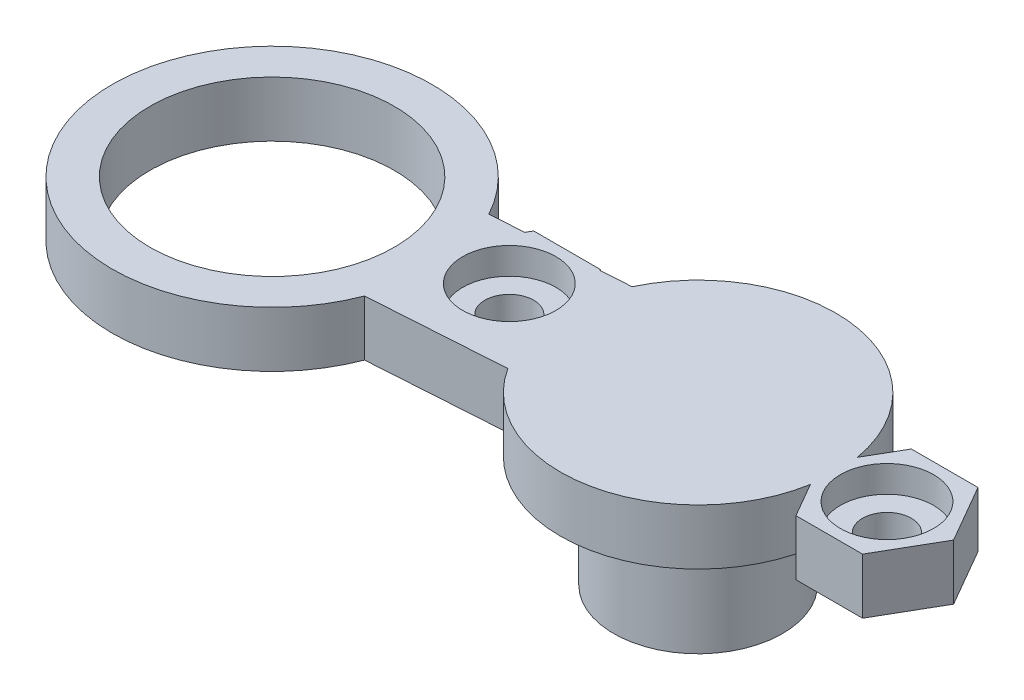
from build123d import *

# Parameters (mm, degrees)
RETAINER_FEATURE_1_PROFILE_R  = 3.8
RETAINER_FEATURE_1_DEPTH      = 5.02
RETAINER_FEATURE_2_PROFILE_R  = 6.2
RETAINER_FEATURE_2_DEPTH      = 2.5
RETAINER_FEATURE_5_DEPTH      = 2.5
RETAINER_FEATURE_8_DEPTH      = 2.5
RETAINER_FEATURE_12_DEPTH     = 2.5
RETAINER_FEATURE_13_PROFILE_R = 7.2
RETAINER_FEATURE_13_DEPTH     = 2.5
RETAINER_FEATURE_14_PROFILE_R = 5.5
RETAINER_FEATURE_14_DEPTH     = 2.7
RETAINER_FEATURE_15_PROFILE_R = 1.1
RETAINER_FEATURE_15_DEPTH     = 3.75
RETAINER_FEATURE_16_PROFILE_R = 2.1
RETAINER_FEATURE_16_DEPTH     = 1.45
RETAINER_FEATURE_17_PROFILE_R = 1.1
RETAINER_FEATURE_17_DEPTH     = 3.75
RETAINER_FEATURE_18_PROFILE_R = 2.1
RETAINER_FEATURE_18_DEPTH     = 1.45


with BuildPart() as part:
    # Retainer Feature 1 profile → Retainer Feature 1 (new body)
    with BuildSketch(Plane(origin=(0, -101, 0), x_dir=(-1, 0, 0), z_dir=(0, -1, 0))):
        with Locations(Location((56.291651246, -30, 0), (0, 0, 90))):
            Circle(RETAINER_FEATURE_1_PROFILE_R)
    extrude(amount=RETAINER_FEATURE_1_DEPTH)

    # Retainer Feature 2 profile → Retainer Feature 2 (add)
    with BuildSketch(Plane(origin=(0, -106, 0), x_dir=(-1, 0, 0), z_dir=(0, -1, 0))):
        with Locations(Location((56.291651246, -30, 0), (0, 0, 90))):
            Circle(RETAINER_FEATURE_2_PROFILE_R)
    extrude(amount=RETAINER_FEATURE_2_DEPTH)

    # Middle Right Floating Compression Ball R → Retainer Feature 5 (add)
    with BuildSketch(Plane(origin=(0, -106, 0), x_dir=(-1, 0, 0), z_dir=(0, -1, 0))):
        Polygon((44.791651246, -30), (46.291651246, -32.598076211), (49.291651246, -32.598076211), (50.791651246, -30), (49.291651246, -27.401923789), (46.291651246, -27.401923789), align=None)
    extrude(amount=RETAINER_FEATURE_5_DEPTH)

    # Middle Right Floating Compression Ba 2 → Retainer Feature 8 (add)
    with BuildSketch(Plane(origin=(0, -106, 0), x_dir=(-1, 0, 0), z_dir=(0, -1, 0))):
        Polygon((61.791651246, -30), (63.291651246, -32.598076211), (66.291651246, -32.598076211), (67.791651246, -30), (66.291651246, -27.401923789), (63.291651246, -27.401923789), align=None)
    extrude(amount=RETAINER_FEATURE_8_DEPTH)

    # Retainer Feature 9 profile → Retainer Feature 9 (revolve, cut)
    with BuildSketch(Plane(origin=(0, -101, 0), x_dir=(-1, 0, 0), z_dir=(0, -1, 0))):
        with BuildLine():
            Line((56.291651246, -33.15), (56.291651246, -26.85))
            ThreePointArc((56.291651246, -26.85), (53.141651246, -30), (56.291651246, -33.15))
        make_face()
    revolve(axis=Axis((-56.291651246, -101, 20), (0, 0, 1)), mode=Mode.SUBTRACT)

    # Middle Right Floating Compression Ba 3 → Retainer Feature 12 (add)
    with BuildSketch(Plane(origin=(0, -106, 0), x_dir=(-1, 0, 0), z_dir=(0, -1, 0))):
        Polygon((56.095916768, -32.993607859), (74.095916768, -34.170522395), (74.487385724, -28.183306677), (56.487385724, -27.006392141), align=None)
    extrude(amount=RETAINER_FEATURE_12_DEPTH)

    # Retainer Feature 13 profile → Retainer Feature 13 (add)
    with BuildSketch(Plane(origin=(0, -106, 0), x_dir=(-1, 0, 0), z_dir=(0, -1, 0))):
        with Locations((74.291651246, -31.176914536)):
            Circle(RETAINER_FEATURE_13_PROFILE_R)
    extrude(amount=RETAINER_FEATURE_13_DEPTH)

    # Retainer Feature 14 profile → Retainer Feature 14 (cut)
    with BuildSketch(Plane(origin=(0, -105.9, 0), x_dir=(-1, 0, 0), z_dir=(0, -1, 0))):
        with Locations(Location((74.291651246, -31.176914536, 0), (0, 0, 270))):
            Circle(RETAINER_FEATURE_14_PROFILE_R)
    extrude(amount=RETAINER_FEATURE_14_DEPTH, mode=Mode.SUBTRACT)

    # Retainer Feature 15 profile → Retainer Feature 15 (cut)
    with BuildSketch(Plane(origin=(0, -105, 0), x_dir=(-1, 0, 0), z_dir=(0, -1, 0))):
        with Locations(Location((47.791651246, -30, 0), (0, 0, 90))):
            Circle(RETAINER_FEATURE_15_PROFILE_R)
    extrude(amount=RETAINER_FEATURE_15_DEPTH, mode=Mode.SUBTRACT)

    # Retainer Feature 16 profile → Retainer Feature 16 (cut)
    with BuildSketch(Plane(origin=(0, -107.3, 0), x_dir=(-1, 0, 0), z_dir=(0, -1, 0))):
        with Locations(Location((47.791651246, -30, 0), (0, 0, 90))):
            Circle(RETAINER_FEATURE_16_PROFILE_R)
    extrude(amount=RETAINER_FEATURE_16_DEPTH, mode=Mode.SUBTRACT)

    # Retainer Feature 17 profile → Retainer Feature 17 (cut)
    with BuildSketch(Plane(origin=(0, -105, 0), x_dir=(-1, 0, 0), z_dir=(0, -1, 0))):
        with Locations(Location((64.791651246, -30, 0), (0, 0, 90))):
            Circle(RETAINER_FEATURE_17_PROFILE_R)
    extrude(amount=RETAINER_FEATURE_17_DEPTH, mode=Mode.SUBTRACT)

    # Retainer Feature 18 profile → Retainer Feature 18 (cut)
    with BuildSketch(Plane(origin=(0, -107.3, 0), x_dir=(-1, 0, 0), z_dir=(0, -1, 0))):
        with Locations(Location((64.791651246, -30, 0), (0, 0, 90))):
            Circle(RETAINER_FEATURE_18_PROFILE_R)
    extrude(amount=RETAINER_FEATURE_18_DEPTH, mode=Mode.SUBTRACT)

    # Articulation Throat Sketch → Articulation Throat (revolve, cut)
    with BuildSketch(Plane(origin=(-75.19414337, -14.119516346, 20.509419779), x_dir=(-0.2544785459472912, -0.04778449262394895, -0.9658971539026421), z_dir=(0.9493062747008634, 0.178255178692775, -0.2589260282064664))):
        Polygon((-9.825663304, -88.876600419), (-8.475389129, -90.738524062), (14.088996194, -82.675837476), (8.793573125, -75.373858667), align=None)
    revolve(axis=Axis((-53.148124615, -106.383086561, 37.819246728), (-0.3143526631246646, 0.5383086561091633, -0.781924672807028)), mode=Mode.SUBTRACT)


with BuildPart() as body_2:
    # Mirror1: mirrored copy
    add(part.part.mirror(Plane(origin=(0, 0, 0), x_dir=(0, 0, 1), z_dir=(0, -1, 0))))


solid = body_2.part
